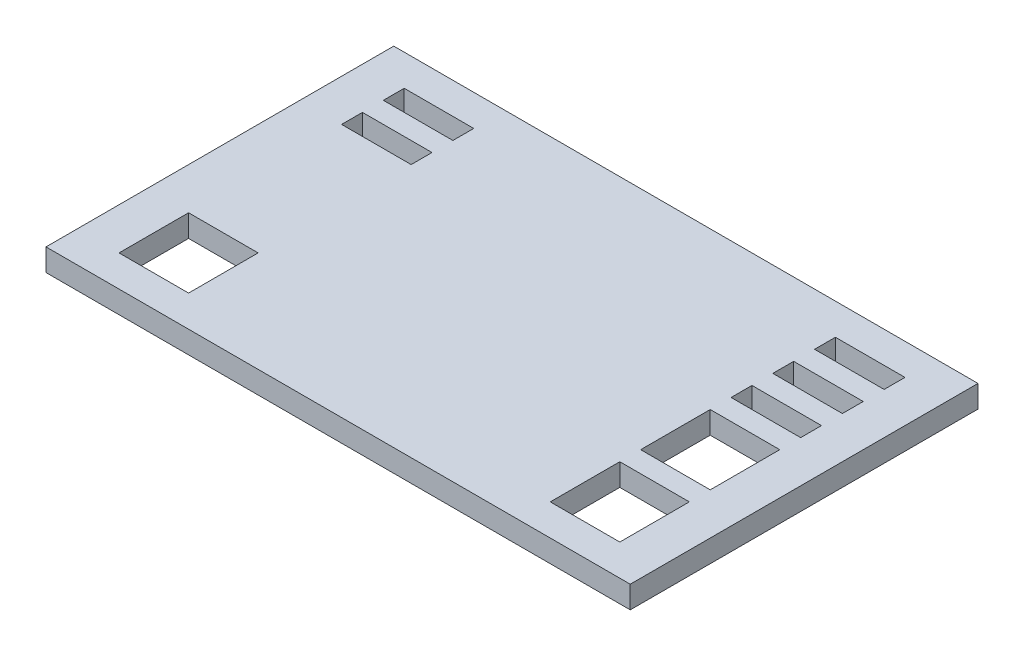
from build123d import *

# Parameters (mm, degrees)
SKETCH1_W           = 48
SKETCH1_H           = 25
SKETCH1_W_2         = 5
SKETCH1_H_2         = 1.5
SKETCH1_H_3         = 5
BOSS_EXTRUDE1_DEPTH = 1.6
SKETCH3_R           = 1
BOSS_EXTRUDE2_DEPTH = 0.5
SKETCH4_R           = 0.75
BOSS_EXTRUDE3_DEPTH = 4.5
SKETCH5_R           = 0.45
BOSS_EXTRUDE4_DEPTH = 2
FILLET1_R           = 0.45
SKETCH6_W           = 3
SKETCH6_H           = 25
CUT_EXTRUDE1_DEPTH  = 10


with BuildPart() as part:
    # Sketch1 → Boss-Extrude1 (new body)
    with BuildSketch(Plane(origin=(0, 0, 0), x_dir=(1, 0, 0), z_dir=(0, 1, 0))):
        Rectangle(SKETCH1_W, SKETCH1_H)
        with Locations((15.5, 3.5)):
            Rectangle(SKETCH1_W_2, SKETCH1_H_2, mode=Mode.SUBTRACT)
        with Locations((15.5, -1.25)):
            Rectangle(SKETCH1_W_2, SKETCH1_H_3, mode=Mode.SUBTRACT)
        with Locations((-15.5, 9.5)):
            Rectangle(SKETCH1_W_2, SKETCH1_H_2, mode=Mode.SUBTRACT)
        with Locations((15.5, 9.5)):
            Rectangle(SKETCH1_W_2, SKETCH1_H_2, mode=Mode.SUBTRACT)
        with Locations((15.5, 6.5)):
            Rectangle(SKETCH1_W_2, SKETCH1_H_2, mode=Mode.SUBTRACT)
        with Locations((15.5, -7.75)):
            Rectangle(SKETCH1_W_2, SKETCH1_H_3, mode=Mode.SUBTRACT)
        with Locations((-15.5, -7.75)):
            Rectangle(SKETCH1_W_2, SKETCH1_H_3, mode=Mode.SUBTRACT)
        with Locations((-15.5, 6.5)):
            Rectangle(SKETCH1_W_2, SKETCH1_H_2, mode=Mode.SUBTRACT)
    extrude(amount=BOSS_EXTRUDE1_DEPTH)

    # Sketch3 → Boss-Extrude2 (add)
    with BuildSketch(Plane.XZ):
        with Locations(Location((0, 0, 0), (0, 0, 90))):
            Circle(SKETCH3_R)
        with Locations(Location((0, -5, 0), (0, 0, 90))):
            Circle(SKETCH3_R)
    extrude(amount=BOSS_EXTRUDE2_DEPTH)

    # Sketch4 → Boss-Extrude3 (add)
    with BuildSketch(Plane.XZ.offset(0.5)):
        with Locations(Location((0, 0, 0), (0, 0, 270))):
            Circle(SKETCH4_R)
        with Locations(Location((0, -5, 0), (0, 0, 270))):
            Circle(SKETCH4_R)
    extrude(amount=BOSS_EXTRUDE3_DEPTH)

    # Sketch5 → Boss-Extrude4 (add)
    with BuildSketch(Plane.XZ.offset(5)):
        with Locations(Location((0, 0, 0), (0, 0, 270))):
            Circle(SKETCH5_R)
        with Locations(Location((0, -5, 0), (0, 0, 270))):
            Circle(SKETCH5_R)
    extrude(amount=BOSS_EXTRUDE4_DEPTH)

    # Fillet1
    fillet1_edges = [part.edges().sort_by_distance(p)[0] for p in [
        (0, -7, 0.45),
        (0, -7, -4.55),
    ]]
    fillet(fillet1_edges, radius=FILLET1_R)

    # Sketch6 → Cut-Extrude1 (cut)
    with BuildSketch(Plane.XZ):
        with Locations((-22.5, 0)):
            Rectangle(SKETCH6_W, SKETCH6_H)
        with Locations((22.5, 0)):
            Rectangle(SKETCH6_W, SKETCH6_H)
    extrude(amount=-CUT_EXTRUDE1_DEPTH, mode=Mode.SUBTRACT)


solid = part.part
